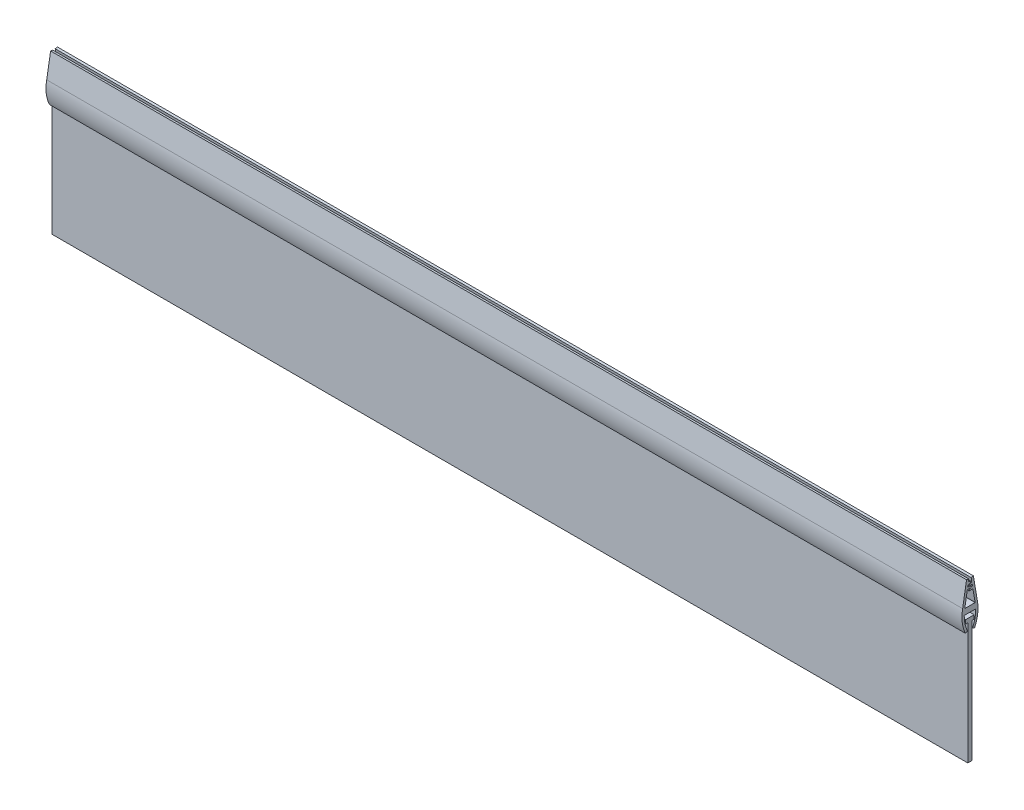
from build123d import *

# Parameters (mm, degrees)
EXTRUDE_2_DEPTH = 200
SKETCH_2_W      = 3.757825485
SKETCH_2_H      = 1.678700728
EXTRUDE_3_DEPTH = 400
SKETCH_3_W      = 1.861931739
SKETCH_3_H      = 53
EXTRUDE_4_DEPTH = 400


with BuildPart() as part:
    # Эскиз1 → Бобышка-Вытянуть2 (new, symmetric)
    with BuildSketch(Plane(origin=(0, 0, 0), x_dir=(0, 0, -1), z_dir=(1, 0, 0))):
        with BuildLine():
            Line((-1.2, 9.927738917), (0.5, 20))
            Line((0.5, 20), (1.486053856, 19.833573461))
            Line((1.486053856, 19.833573461), (1.318158995, 18.838820003))
            Line((1.318158995, 18.838820003), (2.285826961, 18.448598787))
            Line((2.285826961, 18.448598787), (2.285826961, 17.948310487))
            Line((2.285826961, 17.948310487), (1.129142211, 17.718922123))
            Line((1.129142211, 17.718922123), (1.007869448, 17.000398045))
            Line((1.007869448, 17.000398045), (2.350585212, 16.773773975))
            Line((2.350585212, 16.773773975), (2.350585212, 16.108568155))
            Line((2.350585212, 16.108568155), (0.857346065, 16.108568155))
            Line((0.857346065, 16.108568155), (-0.216510865, 9.746116765))
            ThreePointArc((-0.216510865, 9.746116765), (-0.240713688, 9.623157339), (-0.2638884, 9.5))
            Line((-0.2638884, 9.5), (4.2638884, 9.5))
            ThreePointArc((4.2638884, 9.5), (4.240713688, 9.623157339), (4.216510865, 9.746116765))
            Line((4.216510865, 9.746116765), (3.292845859, 15.218702118))
            Line((3.292845859, 15.218702118), (1.599884262, 15.218702118))
            Line((1.599884262, 15.218702118), (1.599884262, 15.758424824))
            Line((1.599884262, 15.758424824), (3.094446449, 16.394190736))
            Line((3.094446449, 16.394190736), (2.961073194, 17.184408525))
            Line((2.961073194, 17.184408525), (1.599884262, 16.954666547))
            Line((1.599884262, 16.954666547), (1.599884262, 17.460695313))
            Line((1.599884262, 17.460695313), (2.800267704, 18.137158455))
            Line((2.800267704, 18.137158455), (2.513946144, 19.833573461))
            Line((2.513946144, 19.833573461), (3.5, 20))
            Line((3.5, 20), (5.2, 9.927738917))
            ThreePointArc((5.2, 9.927738917), (5.395525451, 4.867711557), (4, 0))
            Line((4, 0), (3.094446449, 0.424231972))
            ThreePointArc((3.094446449, 0.424231972), (4.175386024, 3.63176765), (4.509640896, 7))
            Line((4.509640896, 7), (-0.509640896, 7))
            ThreePointArc((-0.509640896, 7), (-0.175386024, 3.63176765), (0.905553551, 0.424231972))
            Line((0.905553551, 0.424231972), (0, 0))
            ThreePointArc((0, 0), (-1.395525451, 4.867711557), (-1.2, 9.927738917))
        make_face()
    extrude(amount=EXTRUDE_2_DEPTH, both=True)


with BuildPart() as body_2:
    # Эскиз2 → Бобышка-Вытянуть3 (new body)
    with BuildSketch(Plane(origin=(200, 0, 0), x_dir=(0, 0, -1), z_dir=(1, 0, 0))):
        with Locations((1.991137299, 4.265031581)):
            Rectangle(SKETCH_2_W, SKETCH_2_H)
    extrude(amount=-EXTRUDE_3_DEPTH)

    # Эскиз3 → Бобышка-Вытянуть4 (add)
    with BuildSketch(Plane.ZY.offset(200)):
        with Locations((-1.987331142, -23.074318783)):
            Rectangle(SKETCH_3_W, SKETCH_3_H)
    extrude(amount=-EXTRUDE_4_DEPTH)


solid = Compound([part.part, body_2.part])
